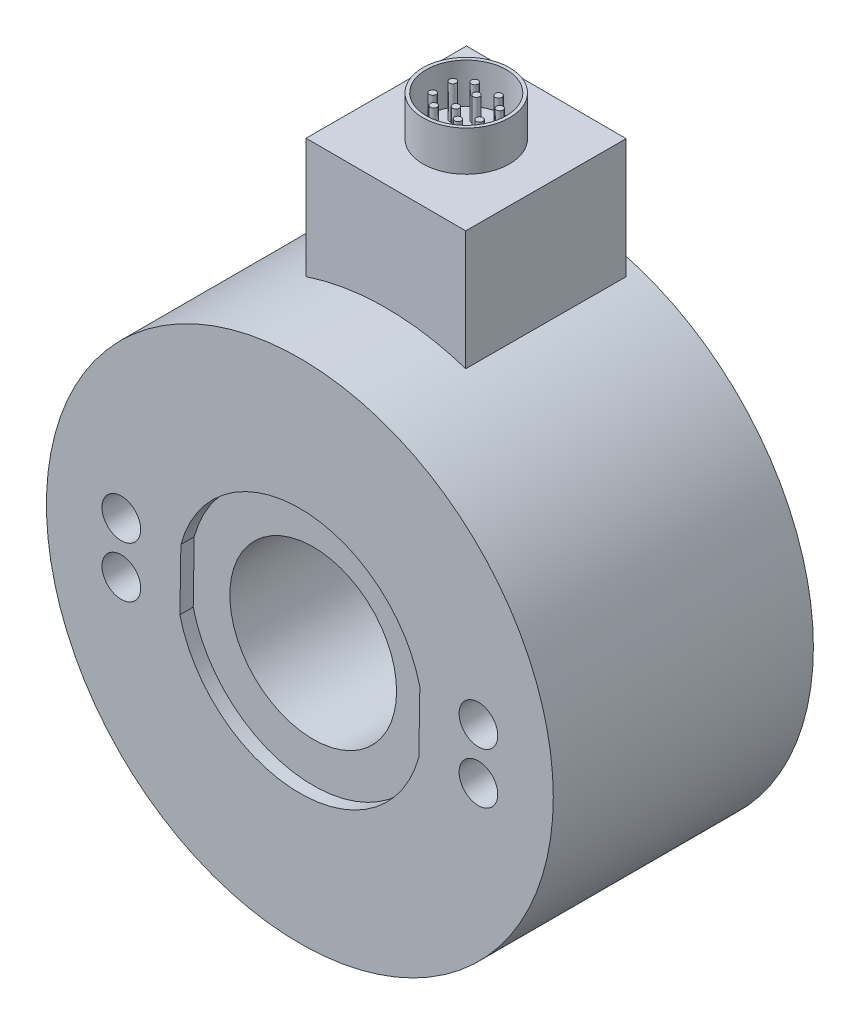
from build123d import *

# Parameters (mm, degrees)
SKETCH_1_R            = 38
EXTRUDE_1_DEPTH       = 39
SKETCH_3_R            = 17.5
EXTRUDE_2_DEPTH       = 7
SKETCH_5_R            = 12
CUT_EXTRUDE_2_DEPTH   = 46
CHAMFER_2_SIZE        = 1
CHAMFER_2_SIZE2       = 0.577350269
SKETCH_6_R            = 12.5
SKETCH_6_R_2          = 12
EXTRUDE_4_DEPTH       = 1
SKETCH_7_R            = 16
SKETCH_7_R_2          = 13
CUT_EXTRUDE_5_DEPTH   = 2
FILLET_5_R            = 1
CUT_EXTRUDE_12_DEPTH  = 2
EXTRUDE_START         = 30
EXTRUDE_7_DEPTH       = 24
SKETCH_16_R           = 6.5
SKETCH_16_R_2         = 6
EXTRUDE_9_DEPTH       = 6
SKETCH_17_R           = 0.5
EXTRUDE_10_DEPTH      = 5
SKETCH_18_R           = 12.5
CUT_EXTRUDE_13_DEPTH  = 86.164546614
SKETCH_19_R           = 17.5
CUT_EXTRUDE_14_DEPTH  = 7
HOLE_WIZARD_M51_D     = 5.8
HOLE_WIZARD_M51_DEPTH = 14
HOLE_WIZARD_M51_TIP   = 1.742495795


with BuildPart() as part:
    # Эскиз1 → Бобышка-Вытянуть1 (new body)
    with BuildSketch(Plane.XY):
        Circle(SKETCH_1_R)
    extrude(amount=EXTRUDE_1_DEPTH)

    # Эскиз3 → Бобышка-Вытянуть2 (add)
    with BuildSketch(Plane.XY.offset(39)):
        Circle(SKETCH_3_R)
    extrude(amount=EXTRUDE_2_DEPTH)

    # Эскиз5 → Вырез-Вытянуть2 (cut)
    with BuildSketch(Plane.XY.offset(46)):
        Circle(SKETCH_5_R)
    extrude(amount=-CUT_EXTRUDE_2_DEPTH, mode=Mode.SUBTRACT)

    # Фаска2
    chamfer_2_edges = [part.edges().sort_by_distance(p)[0] for p in [
        (-12, 0, 46),
    ]]
    chamfer_2_side = [part.faces().sort_by_distance(p)[0] for p in [
        (-17.005025253, 0, 46),
    ]]
    chamfer(chamfer_2_edges, length=CHAMFER_2_SIZE, length2=CHAMFER_2_SIZE2, reference=chamfer_2_side[0])

    # Эскиз6 → Бобышка-Вытянуть4 (add)
    with BuildSketch(Plane(origin=(0, 0, 0), x_dir=(-1, 0, 0), z_dir=(0, 0, -1))):
        with Locations(Location((0, 0, 0), (0, 0, 180))):
            Circle(SKETCH_6_R)
        with Locations(Location((0, 0, 0), (0, 0, 180))):
            Circle(SKETCH_6_R_2, mode=Mode.SUBTRACT)
    extrude(amount=EXTRUDE_4_DEPTH)

    # Эскиз7 → Вырез-Вытянуть5 (cut)
    with BuildSketch(Plane(origin=(0, 0, 0), x_dir=(-1, 0, 0), z_dir=(0, 0, -1))):
        Circle(SKETCH_7_R)
        Circle(SKETCH_7_R_2, mode=Mode.SUBTRACT)
    extrude(amount=-CUT_EXTRUDE_5_DEPTH, mode=Mode.SUBTRACT)

    # Скругление5
    fillet_5_edges = [part.edges().sort_by_distance(p)[0] for p in [
        (16, 0, 0),
    ]]
    fillet(fillet_5_edges, radius=FILLET_5_R)

    # Эскиз8 → Вырез-Вытянуть12 (cut)
    with BuildSketch(Plane.XY.offset(39)):
        with BuildLine():
            Line((17.98928511, 4.316899492), (17.840599274, -4.895203525))
            ThreePointArc((17.840599274, -4.895203525), (-0.298556122, -18.497590769), (-17.98928511, -4.316899492))
            Line((-17.98928511, -4.316899492), (-17.840599274, 4.895203525))
            ThreePointArc((-17.840599274, 4.895203525), (0.298556122, 18.497590769), (17.98928511, 4.316899492))
        make_face()
    extrude(amount=-CUT_EXTRUDE_12_DEPTH, mode=Mode.SUBTRACT)


with BuildPart() as cut_extrude_12_piece_1:
    # of the separate pieces the step leaves, piece 1, a body of its own (cut_extrude_12_pieces)
    add(part.part.solids().sort_by_distance((-17, 0, 0))[0])

    # Эскиз10 → Бобышка-Вытянуть7 (add)
    with BuildSketch(Plane(origin=(0, 0, 0), x_dir=(1, 0, 0), z_dir=(0, 1, 0)).offset(EXTRUDE_START)):
        Polygon((-12.104871286, -25.970188702), (11.895058188, -26.028371648), (11.953241134, -2.028442174), (-12.04668834, -1.970259229), align=None)
    extrude(amount=EXTRUDE_7_DEPTH)

    # Эскиз16 → Бобышка-Вытянуть9 (add)
    with BuildSketch(Plane(origin=(0, 54, 0), x_dir=(1, 0, 0), z_dir=(0, 1, 0))):
        with Locations(Location((0, -14.052210171, 0), (0, 0, 90))):
            Circle(SKETCH_16_R)
        with Locations(Location((0, -14.052210171, 0), (0, 0, 270))):
            Circle(SKETCH_16_R_2, mode=Mode.SUBTRACT)
    extrude(amount=EXTRUDE_9_DEPTH)

    # Эскиз17 → Бобышка-Вытянуть10 (add)
    with BuildSketch(Plane(origin=(0, 54, 0), x_dir=(1, 0, 0), z_dir=(0, 1, 0))):
        with Locations(Location((-3.512245794, -12.5530062, 0), (0, 0, 90))):
            Circle(SKETCH_17_R)
        with Locations(Location((0.020111582, -12.538765356, 0), (0, 0, 90))):
            Circle(SKETCH_17_R)
        with Locations(Location((3.508572113, -12.538765356, 0), (0, 0, 90))):
            Circle(SKETCH_17_R)
        with Locations(Location((3.471979869, -15.527131894, 0), (0, 0, 90))):
            Circle(SKETCH_17_R)
        with Locations(Location((-0.016480661, -15.588118967, 0), (0, 0, 90))):
            Circle(SKETCH_17_R)
        with Locations(Location((-3.529336021, -15.551526723, 0), (0, 0, 90))):
            Circle(SKETCH_17_R)
        with Locations(Location((-1.746429893, -11.03259915, 0), (0, 0, 90))):
            Circle(SKETCH_17_R)
        with Locations(Location((1.76817255, -10.974982716, 0), (0, 0, 90))):
            Circle(SKETCH_17_R)
        with Locations(Location((1.782576658, -17.082324667, 0), (0, 0, 90))):
            Circle(SKETCH_17_R)
        with Locations(Location((-1.804046327, -17.125536992, 0), (0, 0, 90))):
            Circle(SKETCH_17_R)
    extrude(amount=EXTRUDE_10_DEPTH)


with BuildPart() as cut_extrude_12_piece_2:
    # of the separate pieces the step leaves, piece 2, a body of its own (cut_extrude_12_pieces)
    add(part.part.solids().sort_by_distance((17.5, 0, 39))[0])


with BuildPart() as cut_extrude_13_tool:
    # Эскиз18 → Вырез-Вытянуть13 (new, through all)
    with BuildSketch(Plane(origin=(0, 0, -1), x_dir=(-1, 0, 0), z_dir=(0, 0, -1))):
        with Locations(Location((0, 0, 0), (0, 0, 180))):
            Circle(SKETCH_18_R)
    extrude(amount=-CUT_EXTRUDE_13_DEPTH)


with BuildPart() as cut_extrude_12_piece_1_1:
    add(cut_extrude_12_piece_1.part)

    # Вырез-Вытянуть13: cut by cut_extrude_13_tool
    add(cut_extrude_13_tool.part, mode=Mode.SUBTRACT)

    # Отверстие с зазором M51
    with Locations(Plane(origin=(-26.772593493, 3.813867052, 39), x_dir=(1, 0, 0), z_dir=(0, 0, 1))):
        with Locations((0, 0), (0, -7.627734104), (53.545186986, 0), (53.545186986, -7.627734104)):
            Hole(HOLE_WIZARD_M51_D / 2, depth=HOLE_WIZARD_M51_DEPTH)
            with Locations((0, 0, -(HOLE_WIZARD_M51_DEPTH + HOLE_WIZARD_M51_TIP / 2))):  # 118° drill point
                Cone(0, HOLE_WIZARD_M51_D / 2, HOLE_WIZARD_M51_TIP, mode=Mode.SUBTRACT)


with BuildPart() as cut_extrude_12_piece_2_1:
    add(cut_extrude_12_piece_2.part)

    # Вырез-Вытянуть13: cut by cut_extrude_13_tool
    add(cut_extrude_13_tool.part, mode=Mode.SUBTRACT)

    # Эскиз19 → Вырез-Вытянуть14 (cut)
    with BuildSketch(Plane.XY.offset(46)):
        Circle(SKETCH_19_R)
    extrude(amount=-CUT_EXTRUDE_14_DEPTH, mode=Mode.SUBTRACT)


solid = cut_extrude_12_piece_1_1.part
